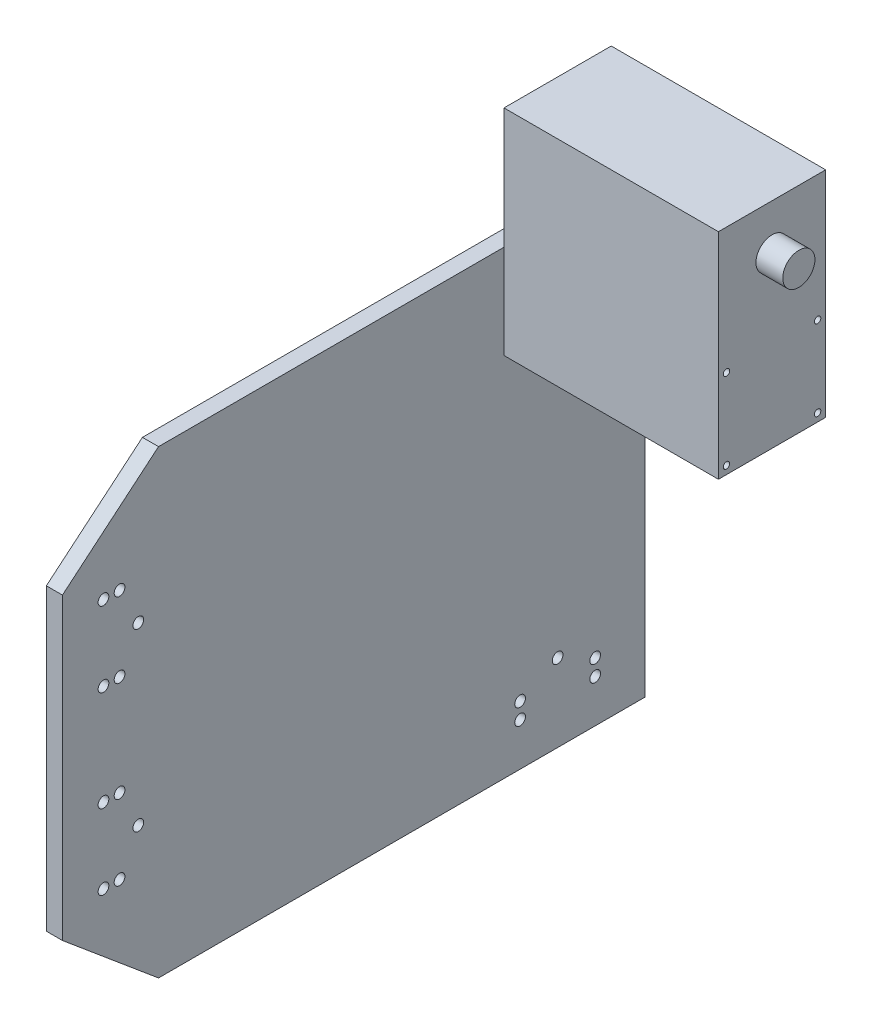
from build123d import *

# Parameters (mm, degrees)
SKETCH_1_W           = 20
SKETCH_1_H           = 40
EXTRUDE_1_DEPTH      = 40
SKETCH_2_R           = 0.6
CUT_EXTRUDE_1_DEPTH  = 5
EXTRUDE_3_DEPTH      = 5
EXTRUDE_3_DEPTH_BACK = 45
SKETCH_3_R           = 3
SKETCH_4_R           = 1
CUT_EXTRUDE_2_DEPTH  = 5
EXTRUDE_START        = -3
SKETCH_5_R           = 1
EXTRUDE_4_DEPTH      = 3


with BuildPart() as part:
    # ｽｹｯﾁ1 → ﾎﾞｽ - 押し出し1 (new body)
    with BuildSketch(Plane(origin=(0, 0, 0), x_dir=(0, 0, -1), z_dir=(1, 0, 0))):
        with Locations((18.409001804, -0.200935369)):
            Rectangle(SKETCH_1_W, SKETCH_1_H)
    extrude(amount=EXTRUDE_1_DEPTH)

    # ｽｹｯﾁ2 → ｶｯﾄ - 押し出し1 (cut)
    with BuildSketch(Plane(origin=(40, 0, 0), x_dir=(0, 0, -1), z_dir=(1, 0, 0))):
        with Locations((26.909001804, -18.700935369)):
            Circle(SKETCH_2_R)
        with Locations((26.909001804, -3.700935369)):
            Circle(SKETCH_2_R)
        with Locations(Location((9.909001804, -3.700935369, 0), (0, 0, 180))):
            Circle(SKETCH_2_R)
        with Locations(Location((9.909001804, -18.700935369, 0), (0, 0, 180))):
            Circle(SKETCH_2_R)
    extrude(amount=-CUT_EXTRUDE_1_DEPTH, mode=Mode.SUBTRACT)

    # ｽｹｯﾁ3 → ﾎﾞｽ - 押し出し3 (add, two sides: drawn at the far end of the back side and taken through both)
    with BuildSketch(Plane(origin=(40, 0, 0), x_dir=(0, 0, -1), z_dir=(1, 0, 0)).offset(-EXTRUDE_3_DEPTH_BACK)):
        with Locations((18.409001804, 11.299064631)):
            Circle(SKETCH_3_R)
    extrude(amount=EXTRUDE_3_DEPTH + EXTRUDE_3_DEPTH_BACK)

    # ｽｹｯﾁ4 → ｶｯﾄ - 押し出し2 (cut)
    with BuildSketch(Plane.ZY):
        with Locations((-11.409001804, -13.700935369)):
            Circle(SKETCH_4_R)
        with Locations((-25.409001804, -13.700935369)):
            Circle(SKETCH_4_R)
        with Locations(Location((-26.409001804, 2.299064631, 0), (0, 0, 180))):
            Circle(SKETCH_4_R)
        with Locations((-10.409001804, 2.299064631)):
            Circle(SKETCH_4_R)
        with Locations((-11.409001804, -10.700935369)):
            Circle(SKETCH_4_R)
        with Locations(Location((-25.409001804, -10.700935369, 0), (0, 0, 180))):
            Circle(SKETCH_4_R)
        with Locations((-18.409001804, -17.200935369)):
            Circle(SKETCH_4_R)
    extrude(amount=-CUT_EXTRUDE_2_DEPTH, mode=Mode.SUBTRACT)

    # ｽｹｯﾁ5 → ﾎﾞｽ - 押し出し4 (add)
    with BuildSketch(Plane(origin=(0, 0, 0), x_dir=(0, 0, -1), z_dir=(1, 0, 0)).offset(EXTRUDE_START)):
        Polygon((34.742298306, -2.699182148), (-56.038607458, -2.699182148), (-73.963087357, -17.71777437), (-73.963087357, -73.523937735), (-56.038607458, -88.542529958), (34.742298306, -88.542529958), align=None)
        with Locations(Location((11.409001804, -10.700935369, 0), (0, 0, 180))):
            Circle(SKETCH_5_R, mode=Mode.SUBTRACT)
        with Locations(Location((11.409001804, -13.700935369, 0), (0, 0, 180))):
            Circle(SKETCH_5_R, mode=Mode.SUBTRACT)
        with Locations(Location((18.409001804, -17.200935369, 0), (0, 0, 180))):
            Circle(SKETCH_5_R, mode=Mode.SUBTRACT)
        with Locations((25.409001804, -10.700935369)):
            Circle(SKETCH_5_R, mode=Mode.SUBTRACT)
        with Locations(Location((25.409001804, -13.700935369, 0), (0, 0, 180))):
            Circle(SKETCH_5_R, mode=Mode.SUBTRACT)
        with Locations((-66.307722518, -36.25601617)):
            Circle(SKETCH_5_R, mode=Mode.SUBTRACT)
        with Locations((-63.307722518, -36.25601617)):
            Circle(SKETCH_5_R, mode=Mode.SUBTRACT)
        with Locations((-59.807722518, -29.25601617)):
            Circle(SKETCH_5_R, mode=Mode.SUBTRACT)
        with Locations((-66.307722518, -22.25601617)):
            Circle(SKETCH_5_R, mode=Mode.SUBTRACT)
        with Locations((-63.307722518, -22.25601617)):
            Circle(SKETCH_5_R, mode=Mode.SUBTRACT)
        with Locations(Location((25.409001804, -77.540776736, 0), (0, 0, 180))):
            Circle(SKETCH_5_R, mode=Mode.SUBTRACT)
        with Locations(Location((25.409001804, -80.540776736, 0), (0, 0, 180))):
            Circle(SKETCH_5_R, mode=Mode.SUBTRACT)
        with Locations(Location((18.409001804, -74.040776736, 0), (0, 0, 180))):
            Circle(SKETCH_5_R, mode=Mode.SUBTRACT)
        with Locations(Location((11.409001804, -77.540776736, 0), (0, 0, 180))):
            Circle(SKETCH_5_R, mode=Mode.SUBTRACT)
        with Locations(Location((11.409001804, -80.540776736, 0), (0, 0, 180))):
            Circle(SKETCH_5_R, mode=Mode.SUBTRACT)
        with Locations(Location((-63.307722518, -68.985695936, 0), (0, 0, 180))):
            Circle(SKETCH_5_R, mode=Mode.SUBTRACT)
        with Locations(Location((-66.307722518, -68.985695936, 0), (0, 0, 180))):
            Circle(SKETCH_5_R, mode=Mode.SUBTRACT)
        with Locations(Location((-59.807722518, -61.985695936, 0), (0, 0, 180))):
            Circle(SKETCH_5_R, mode=Mode.SUBTRACT)
        with Locations(Location((-63.307722518, -54.985695936, 0), (0, 0, 180))):
            Circle(SKETCH_5_R, mode=Mode.SUBTRACT)
        with Locations(Location((-66.307722518, -54.985695936, 0), (0, 0, 180))):
            Circle(SKETCH_5_R, mode=Mode.SUBTRACT)
    extrude(amount=EXTRUDE_4_DEPTH)


solid = part.part
